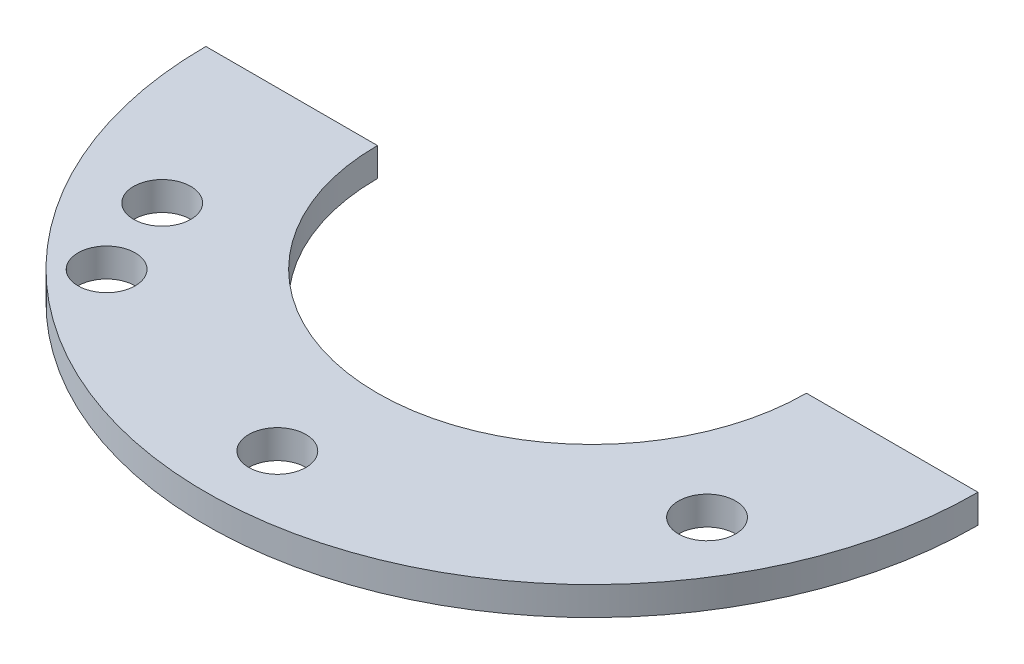
from build123d import *

# Parameters (mm, degrees)
SKETCH1_R               = 13.5
BOSS_EXTRUDE1_DEPTH     = 1
CUT_EXTRUDE1_DEPTH      = 20.118054294
CUT_EXTRUDE1_DEPTH_BACK = 20.118054294
SKETCH19_R              = 1
CUT_EXTRUDE2_DEPTH      = 20.118054294
CUT_EXTRUDE2_DEPTH_BACK = 20.118054294
SKETCH20_R              = 7.5
SKETCH21_W              = 65.874202484
SKETCH21_H              = 51.979273979
CUT_EXTRUDE3_DEPTH      = 20.118054294


with BuildPart() as part:
    # Sketch1 → Boss-Extrude1 (new body)
    with BuildSketch(Plane(origin=(0, 0, 0), x_dir=(1, 0, 0), z_dir=(0, 1, 0))):
        with Locations(Location((0, 0, 0), (0, 0, 270))):
            Circle(SKETCH1_R)
    extrude(amount=BOSS_EXTRUDE1_DEPTH)

    # Sketch19 → Cut-Extrude1 (cut, two sides: drawn at the far end of the back side and taken through both)
    with BuildSketch(Plane(origin=(0, 1, 0), x_dir=(1, 0, 0), z_dir=(0, 1, 0)).offset(-CUT_EXTRUDE1_DEPTH_BACK)):
        with Locations(Location((0, 11, 0), (0, 0, 270))):
            Circle(SKETCH19_R)
        with Locations(Location((9.526279442, 5.5, 0), (0, 0, 270))):
            Circle(SKETCH19_R)
        with Locations(Location((9.526279442, -5.5, 0), (0, 0, 270))):
            Circle(SKETCH19_R)
        with Locations(Location((0, -11, 0), (0, 0, 270))):
            Circle(SKETCH19_R)
        with Locations(Location((-9.526279442, -5.5, 0), (0, 0, 270))):
            Circle(SKETCH19_R)
        with Locations(Location((-9.526279442, 5.5, 0), (0, 0, 270))):
            Circle(SKETCH19_R)
        with Locations(Location((-8.485281374, -8.485281374, 0), (0, 0, 270))):
            Circle(SKETCH19_R)
    extrude(amount=CUT_EXTRUDE1_DEPTH + CUT_EXTRUDE1_DEPTH_BACK, mode=Mode.SUBTRACT)

    # Sketch20 → Cut-Extrude2 (cut, two sides: drawn at the far end of the back side and taken through both)
    with BuildSketch(Plane(origin=(0, 1, 0), x_dir=(1, 0, 0), z_dir=(0, 1, 0)).offset(-CUT_EXTRUDE2_DEPTH_BACK)):
        with Locations(Location((0, 0, 0), (0, 0, 270))):
            Circle(SKETCH20_R)
    extrude(amount=CUT_EXTRUDE2_DEPTH + CUT_EXTRUDE2_DEPTH_BACK, mode=Mode.SUBTRACT)

    # Sketch21 → Cut-Extrude3 (cut, through all)
    with BuildSketch(Plane.XY):
        with Locations((-3.816154381, 6.321647006)):
            Rectangle(SKETCH21_W, SKETCH21_H)
    extrude(amount=-CUT_EXTRUDE3_DEPTH, mode=Mode.SUBTRACT)


solid = part.part
